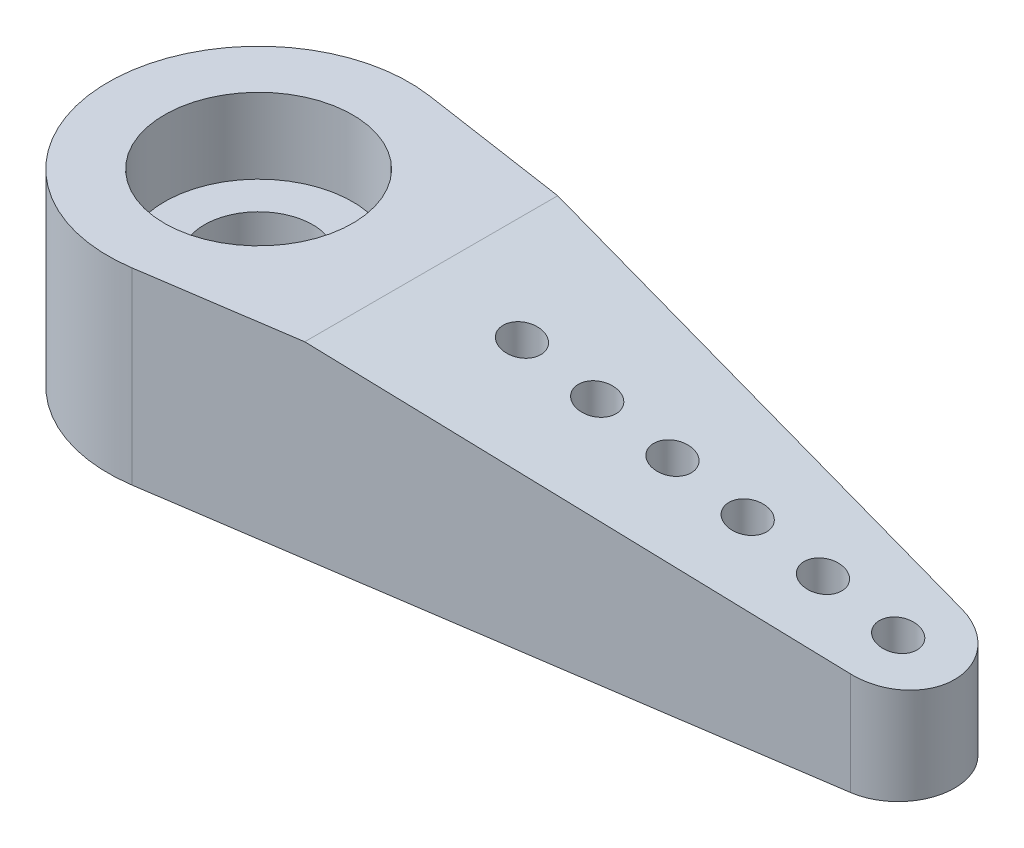
from build123d import *

# Parameters (mm, degrees)
EXTRUDE_1_DEPTH          = 10
CUT_EXTRUDE_1_DEPTH      = 40.153543901
CUT_EXTRUDE_1_DEPTH_BACK = 40.153543901
SKETCH_4_R               = 5
CUT_EXTRUDE_2_DEPTH      = 4
SKETCH_5_R               = 2.88
CUT_EXTRUDE_3_DEPTH      = 6
SKETCH_6_R               = 1
CUT_EXTRUDE_4_DEPTH      = 40.153543901


with BuildPart() as part:
    # Эскиз1 → Бобышка-Вытянуть1 (new body)
    with BuildSketch(Plane(origin=(0, 0, 0), x_dir=(1, 0, 0), z_dir=(0, 1, 0))):
        with BuildLine():
            Line((1.176470588, 7.913021986), (34.441176471, 2.967383245))
            ThreePointArc((34.441176471, 2.967383245), (37, 0), (34.441176471, -2.967383245))
            Line((34.441176471, -2.967383245), (1.176470588, -7.913021986))
            ThreePointArc((1.176470588, -7.913021986), (-8, 0), (1.176470588, 7.913021986))
        make_face()
    extrude(amount=EXTRUDE_1_DEPTH)

    # Эскиз3 → Вырез-Вытянуть1 (cut, two sides: drawn at the far end of the back side and taken through both)
    with BuildSketch(Plane.XY.offset(-CUT_EXTRUDE_1_DEPTH_BACK)):
        Polygon((37, 5), (9.176470588, 10), (37, 10), align=None)
    extrude(amount=CUT_EXTRUDE_1_DEPTH + CUT_EXTRUDE_1_DEPTH_BACK, mode=Mode.SUBTRACT)

    # Эскиз4 → Вырез-Вытянуть2 (cut)
    with BuildSketch(Plane(origin=(0, 10, 0), x_dir=(1, 0, 0), z_dir=(0, 1, 0))):
        with Locations(Location((0, 0, 0), (0, 0, 270))):
            Circle(SKETCH_4_R)
    extrude(amount=-CUT_EXTRUDE_2_DEPTH, mode=Mode.SUBTRACT)

    # Эскиз5 → Вырез-Вытянуть3 (cut)
    with BuildSketch(Plane(origin=(0, 6, 0), x_dir=(1, 0, 0), z_dir=(0, 1, 0))):
        with Locations(Location((0, 0, 0), (0, 0, 270))):
            Circle(SKETCH_5_R)
    extrude(amount=-CUT_EXTRUDE_3_DEPTH, mode=Mode.SUBTRACT)

    # Эскиз6 → Вырез-Вытянуть4 (cut, through all)
    with BuildSketch(Plane.XZ):
        with Locations(Location((34, 0, 0), (0, 0, 270))):
            Circle(SKETCH_6_R)
        with Locations(Location((30, 0, 0), (0, 0, 270))):
            Circle(SKETCH_6_R)
        with Locations(Location((26, 0, 0), (0, 0, 270))):
            Circle(SKETCH_6_R)
        with Locations(Location((22, 0, 0), (0, 0, 270))):
            Circle(SKETCH_6_R)
        with Locations(Location((18, 0, 0), (0, 0, 270))):
            Circle(SKETCH_6_R)
        with Locations(Location((14, 0, 0), (0, 0, 270))):
            Circle(SKETCH_6_R)
    extrude(amount=-CUT_EXTRUDE_4_DEPTH, mode=Mode.SUBTRACT)


solid = part.part
